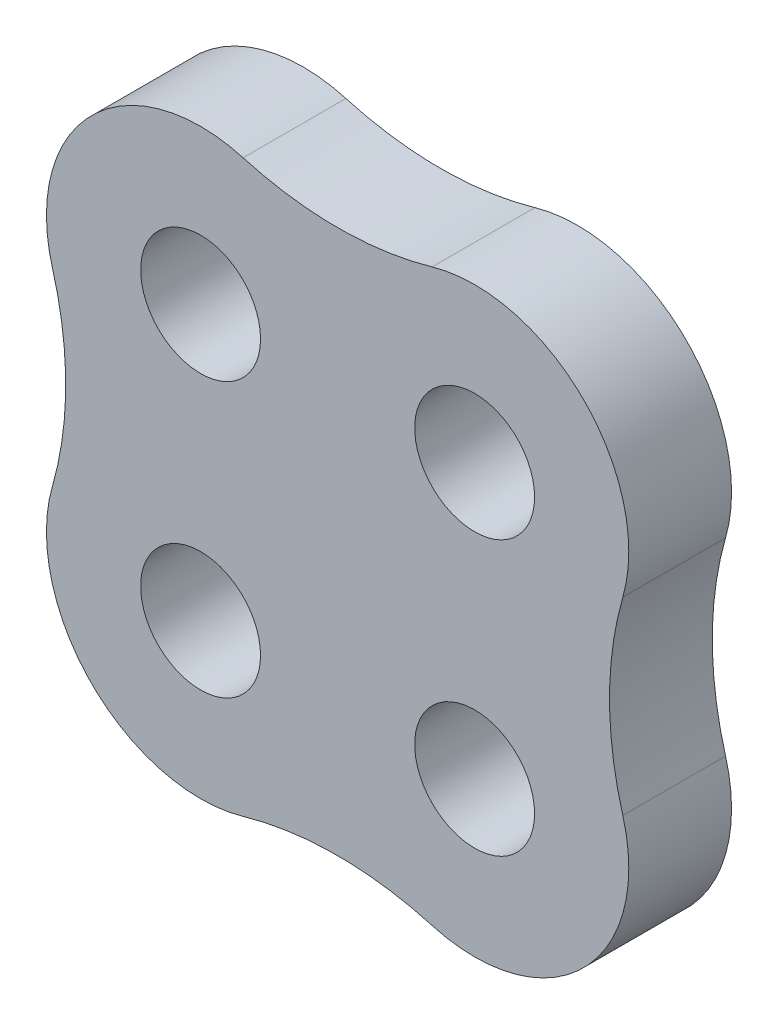
from build123d import *

# Parameters (mm, degrees)
SKETCH_1_R      = 1.75
EXTRUDE_1_DEPTH = 3
FILLET_1_R      = 10


with BuildPart() as part:
    # Эскиз1 → Бобышка-Вытянуть1 (new body)
    with BuildSketch(Plane.XY):
        with BuildLine():
            ThreePointArc((10.061552813, 4), (11.181980515, 11.181980515), (4, 10.061552813))
            ThreePointArc((4, 10.061552813), (-3.181980515, 11.181980515), (-2.061552813, 4))
            ThreePointArc((-2.061552813, 4), (-3.181980515, -3.181980515), (4, -2.061552813))
            ThreePointArc((4, -2.061552813), (11.181980515, -3.181980515), (10.061552813, 4))
        make_face()
        Circle(SKETCH_1_R, mode=Mode.SUBTRACT)
        with Locations((8, 0)):
            Circle(SKETCH_1_R, mode=Mode.SUBTRACT)
        with Locations((0, 8)):
            Circle(SKETCH_1_R, mode=Mode.SUBTRACT)
        with Locations((8, 8)):
            Circle(SKETCH_1_R, mode=Mode.SUBTRACT)
    extrude(amount=EXTRUDE_1_DEPTH)

    # Скругление1
    fillet_1_edges = [part.edges().sort_by_distance(p)[0] for p in [
        (10.061552813, 4, 1.5),
        (4, -2.061552813, 1.5),
        (-2.061552813, 4, 1.5),
        (4, 10.061552813, 1.5),
    ]]
    fillet(fillet_1_edges, radius=FILLET_1_R)


solid = part.part
